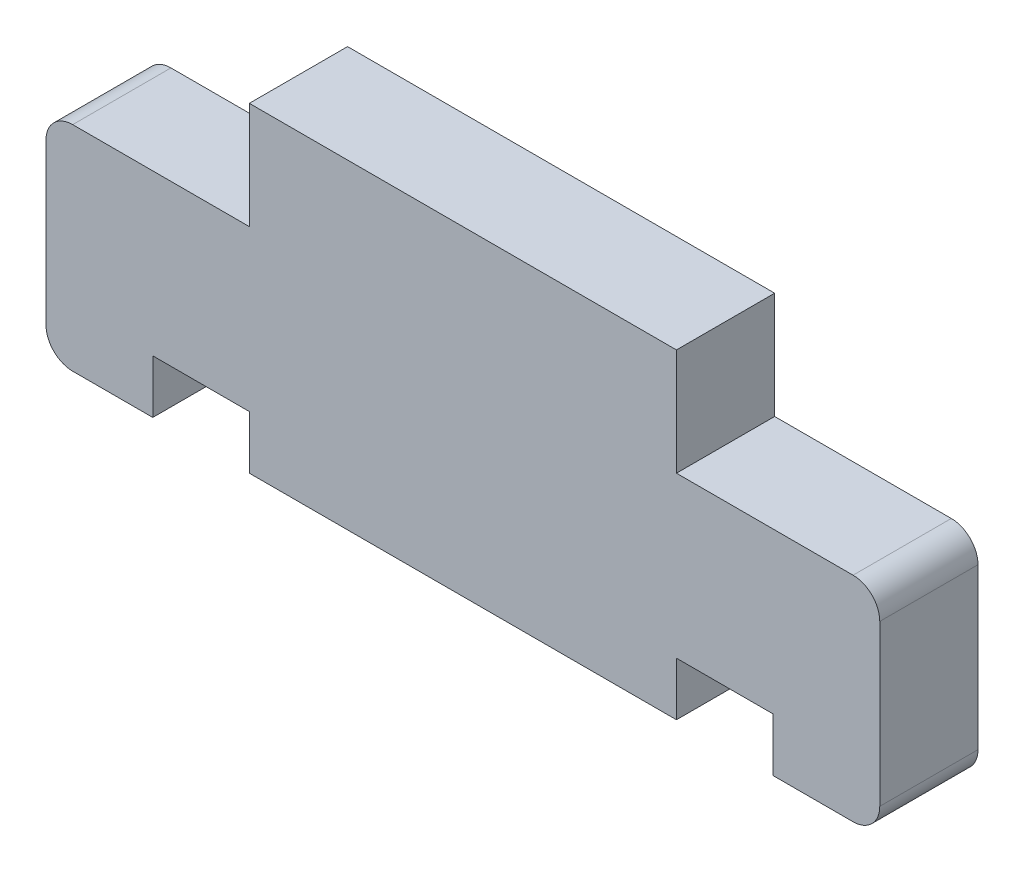
from build123d import *

# Parameters (mm, degrees)
BOSS_EXTRUDE1_DEPTH = 5.842
FILLET1_R           = 1.5875


with BuildPart() as part:
    # Sketch1 → Boss-Extrude1 (new body)
    with BuildSketch(Plane.XY):
        Polygon((12.7, -9.525), (-12.7, -9.525), (-12.7, -6.35), (-18.442, -6.35), (-18.442, -9.525), (-24.792, -9.525), (-24.792, 3.175), (-18.442, 3.175), (-12.7, 3.175), (-12.7, 9.525), (12.7, 9.525), (12.7, 3.175), (18.442, 3.175), (24.792, 3.175), (24.792, -9.525), (18.442, -9.525), (18.442, -6.35), (12.7, -6.35), align=None)
    extrude(amount=BOSS_EXTRUDE1_DEPTH)

    # Fillet1
    fillet1_edges = [part.edges().sort_by_distance(p)[0] for p in [
        (24.792, 3.175, 2.921),
        (24.792, -9.525, 2.921),
        (-24.792, -9.525, 2.921),
        (-24.792, 3.175, 2.921),
    ]]
    fillet(fillet1_edges, radius=FILLET1_R)


solid = part.part
